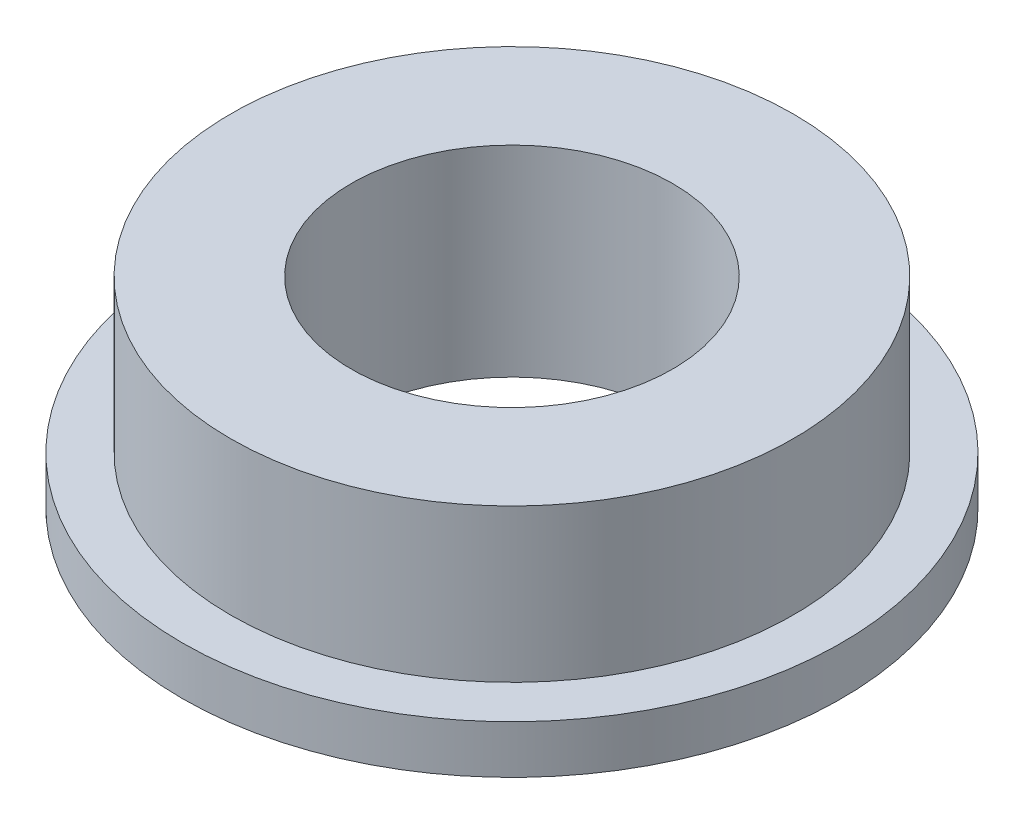
from build123d import *

# Parameters (mm, degrees)
SKETCH_1_R      = 4.1
EXTRUDE_1_DEPTH = 0.6
SKETCH_2_R      = 3.5
EXTRUDE_2_DEPTH = 1.9
HOLE_WIZARD_1_D = 4


with BuildPart() as part:
    # 草图1 → 凸台-拉伸1 (new body)
    with BuildSketch(Plane(origin=(0, 0, 0), x_dir=(1, 0, 0), z_dir=(0, 1, 0))):
        with Locations(Location((0, 0, 0), (0, 0, 270))):
            Circle(SKETCH_1_R)
    extrude(amount=EXTRUDE_1_DEPTH)

    # 草图2 → 凸台-拉伸2 (add)
    with BuildSketch(Plane(origin=(0, 0.6, 0), x_dir=(1, 0, 0), z_dir=(0, 1, 0))):
        with Locations(Location((0, 0, 0), (0, 0, 90))):
            Circle(SKETCH_2_R)
    extrude(amount=EXTRUDE_2_DEPTH)

    # 孔1 (through all)
    with Locations(Plane(origin=(0, 0, 0), x_dir=(-1, 0, 0), z_dir=(0, -1, 0))):
        with Locations((0, 0)):
            Hole(HOLE_WIZARD_1_D / 2)


solid = part.part
